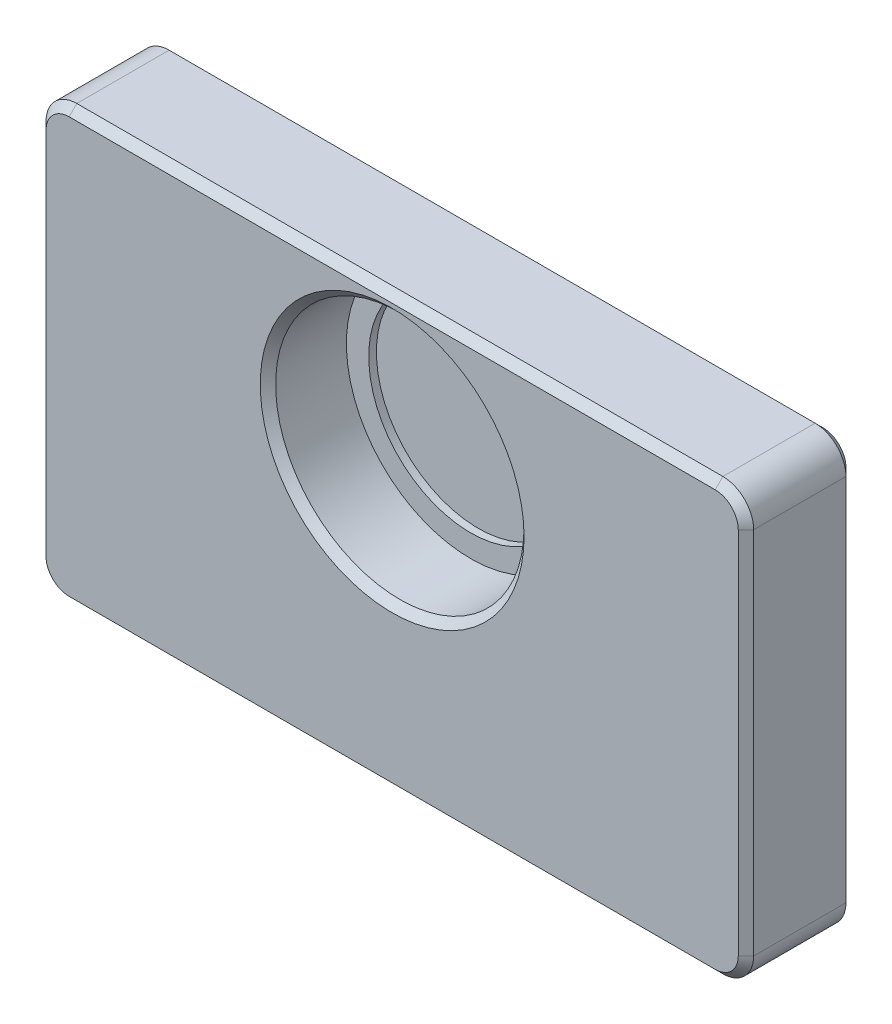
from build123d import *

# Parameters (mm, degrees)
SKIZZE1_W                       = 46
SKIZZE1_H                       = 28
AUFSATZ_LINEAR_AUSTRAGEN1_DEPTH = 7
SKIZZE2_R                       = 8.075
SCHNITT_LINEAR_AUSTRAGEN1_DEPTH = 5.6
AUFSATZ_LINEAR_START            = 0.5
SKIZZE10_R                      = 8.075
SKIZZE10_R_2                    = 6.625
AUFSATZ_LINEAR_AUSTRAGEN2_DEPTH = 0.5
VERRUNDUNG1_R                   = 2
SKIZZE11_R                      = 2.2
SCHNITT_LINEAR_AUSTRAGEN8_DEPTH = 8
FASE1_SIZE                      = 0.5


with BuildPart() as part:
    # Skizze1 → Aufsatz-Linear austragen1 (new body)
    with BuildSketch(Plane.XY):
        Rectangle(SKIZZE1_W, SKIZZE1_H)
    extrude(amount=AUFSATZ_LINEAR_AUSTRAGEN1_DEPTH)

    # Skizze2 → Schnitt-Linear austragen1 (cut)
    with BuildSketch(Plane.XY.offset(7)):
        with Locations((0, 4.65)):
            Circle(SKIZZE2_R)
    extrude(amount=-SCHNITT_LINEAR_AUSTRAGEN1_DEPTH, mode=Mode.SUBTRACT)

    # Skizze10 → Aufsatz-Linear austragen2 (add)
    with BuildSketch(Plane.XY.offset(1.4).offset(AUFSATZ_LINEAR_START)):
        with Locations((0, 4.65)):
            Circle(SKIZZE10_R)
        with Locations((0, 4.65)):
            Circle(SKIZZE10_R_2, mode=Mode.SUBTRACT)
    extrude(amount=-AUFSATZ_LINEAR_AUSTRAGEN2_DEPTH)

    # Verrundung1
    verrundung1_edges = [part.edges().sort_by_distance(p)[0] for p in [
        (23, 14, 3.5),
        (23, -14, 3.5),
        (-23, 14, 3.5),
        (-23, -14, 3.5),
    ]]
    fillet(verrundung1_edges, radius=VERRUNDUNG1_R)

    # Skizze11 → Schnitt-Linear austragen8 (cut)
    with BuildSketch(Plane.XZ.offset(14)):
        with Locations((0, 3.5)):
            Circle(SKIZZE11_R)
    extrude(amount=-SCHNITT_LINEAR_AUSTRAGEN8_DEPTH, mode=Mode.SUBTRACT)

    # Fase1
    fase1_edges = [part.edges().sort_by_distance(p)[0] for p in [
        (22.414213562, -13.414213562, 7),
        (0, -14, 7),
        (-22.414213562, -13.414213562, 7),
        (-23, 0, 7),
        (-22.414213562, 13.414213562, 7),
        (0, 14, 7),
        (22.414213562, 13.414213562, 7),
        (23, 0, 7),
        (-8.075, 4.65, 7),
        (-22.414213562, 13.414213562, 0),
        (-23, 0, 0),
        (-22.414213562, -13.414213562, 0),
        (0, -14, 0),
        (22.414213562, -13.414213562, 0),
        (23, 0, 0),
        (22.414213562, 13.414213562, 0),
        (0, 14, 0),
    ]]
    chamfer(fase1_edges, length=FASE1_SIZE)


solid = part.part
